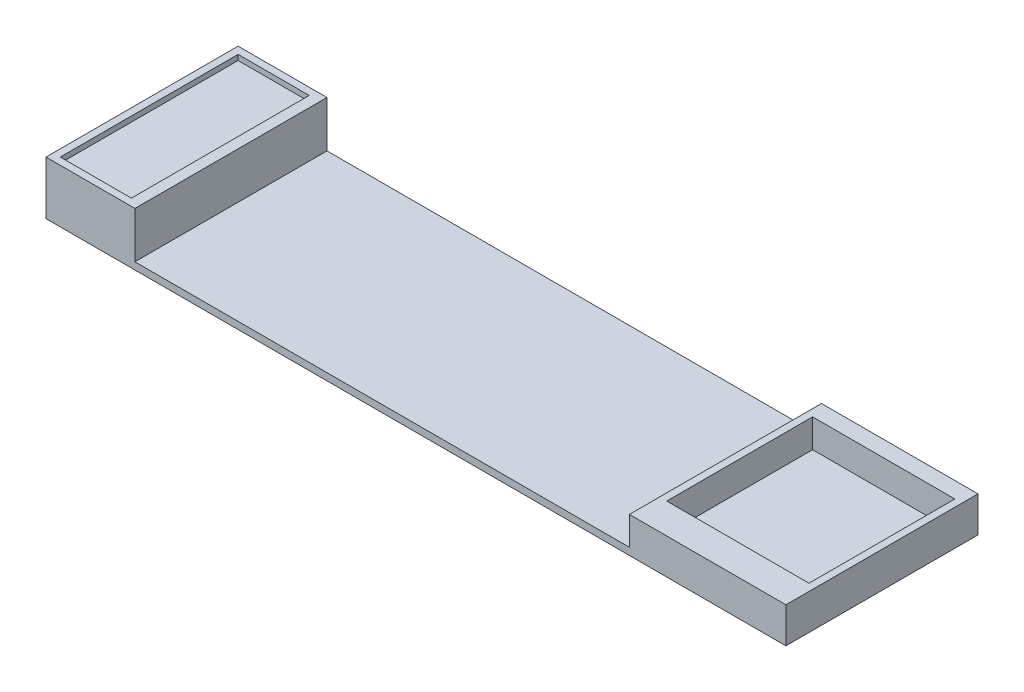
from build123d import *

# Parameters (mm, degrees)
SKETCH2_W           = 208
SKETCH2_H           = 54
BOSS_EXTRUDE1_DEPTH = 10
SKETCH4_W           = 139
SKETCH4_H           = 54
CUT_EXTRUDE1_DEPTH  = 8
SKETCH3_W           = 40
SKETCH3_H           = 41
CUT_EXTRUDE2_DEPTH  = 8
SKETCH6_W           = 25
SKETCH6_H           = 54
BOSS_EXTRUDE2_DEPTH = 5
SKETCH7_W           = 20
SKETCH7_H           = 50
CUT_EXTRUDE3_DEPTH  = 1.5


with BuildPart() as part:
    # Sketch2 → Boss-Extrude1 (new body)
    with BuildSketch(Plane(origin=(0, 0, 0), x_dir=(1, 0, 0), z_dir=(0, 1, 0))):
        Rectangle(SKETCH2_W, SKETCH2_H)
    extrude(amount=BOSS_EXTRUDE1_DEPTH)

    # Sketch4 → Cut-Extrude1 (cut)
    with BuildSketch(Plane(origin=(0, 10, 0), x_dir=(1, 0, 0), z_dir=(0, 1, 0))):
        with Locations((-9.5, 0)):
            Rectangle(SKETCH4_W, SKETCH4_H)
    extrude(amount=-CUT_EXTRUDE1_DEPTH, mode=Mode.SUBTRACT)

    # Sketch3 → Cut-Extrude2 (cut)
    with BuildSketch(Plane(origin=(0, 10, 0), x_dir=(1, 0, 0), z_dir=(0, 1, 0))):
        with Locations((82, 2)):
            Rectangle(SKETCH3_W, SKETCH3_H)
    extrude(amount=-CUT_EXTRUDE2_DEPTH, mode=Mode.SUBTRACT)

    # Sketch6 → Boss-Extrude2 (add)
    with BuildSketch(Plane(origin=(0, 10, 0), x_dir=(1, 0, 0), z_dir=(0, 1, 0))):
        with Locations((-91.5, 0)):
            Rectangle(SKETCH6_W, SKETCH6_H)
    extrude(amount=BOSS_EXTRUDE2_DEPTH)

    # Sketch7 → Cut-Extrude3 (cut)
    with BuildSketch(Plane(origin=(0, 15, 0), x_dir=(1, 0, 0), z_dir=(0, 1, 0))):
        with Locations((-92, 0)):
            Rectangle(SKETCH7_W, SKETCH7_H)
    extrude(amount=-CUT_EXTRUDE3_DEPTH, mode=Mode.SUBTRACT)


solid = part.part
